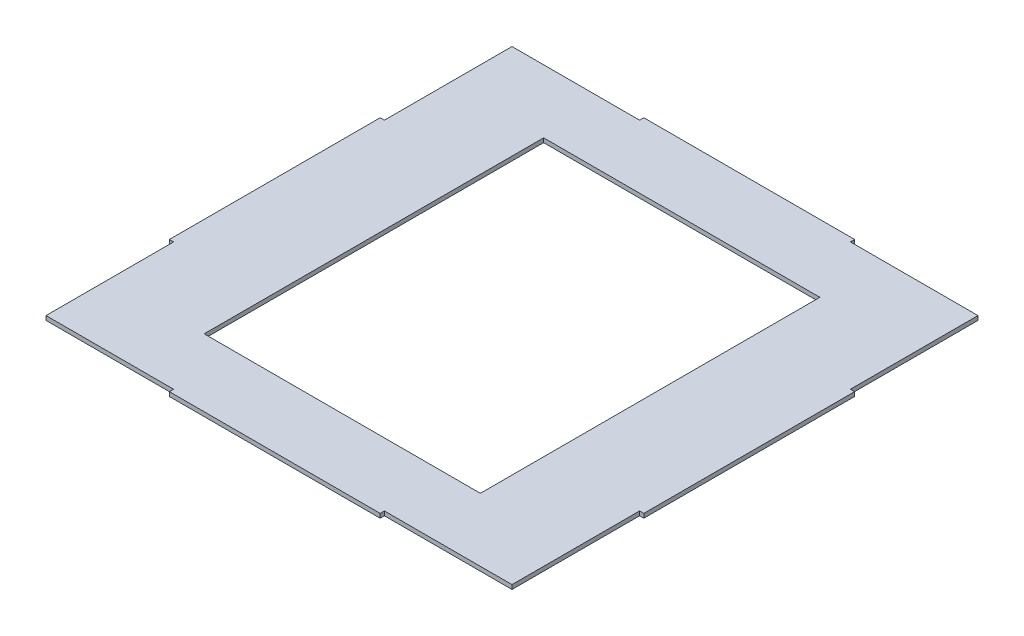
from build123d import *

# Parameters (mm, degrees)
SKETCH1_W           = 262
SKETCH1_H           = 322
BOSS_EXTRUDE1_DEPTH = 4


with BuildPart() as part:
    # Sketch1 → Boss-Extrude1 (new body)
    with BuildSketch(Plane(origin=(0, 0, 0), x_dir=(1, 0, 0), z_dir=(0, 1, 0))):
        Polygon((-221, 100), (-225, 100), (-225, -100), (-221, -100), (-221, -221), (-100, -221), (-100, -225), (100, -225), (100, -221), (221, -221), (221, -100), (225, -100), (225, 100), (221, 100), (221, 221), (100, 221), (100, 225), (-100, 225), (-100, 221), (-221, 221), align=None)
        Rectangle(SKETCH1_W, SKETCH1_H, mode=Mode.SUBTRACT)
    extrude(amount=BOSS_EXTRUDE1_DEPTH)


solid = part.part
